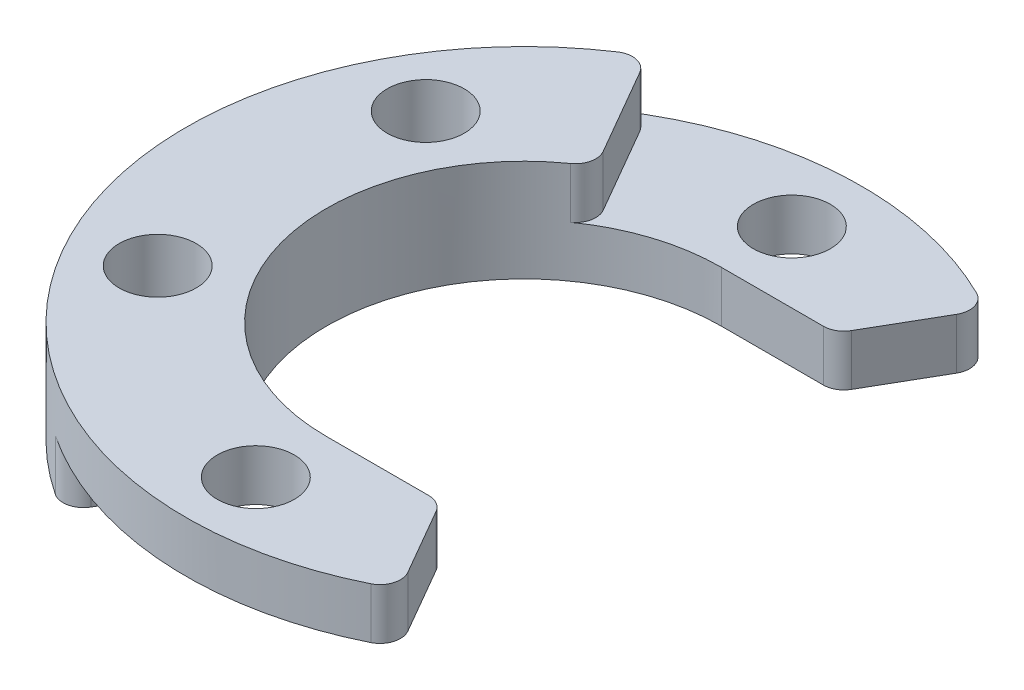
from build123d import *

# Parameters (mm, degrees)
SKETCH1_R      = 42.09650726
SKETCH1_R_2    = 24.599219473
SKETCH1_R_3    = 4.801304322
EXTRUDE1_DEPTH = 12.7
EXTRUDE2_DEPTH = 61.872997683
EXTRUDE3_DEPTH = 6.35
EXTRUDE4_DEPTH = 6.35
SKETCH6_W      = 38.310280967
SKETCH6_H      = 49.198438946
EXTRUDE5_DEPTH = 61.872997683
FILLET1_R      = 2.54
FILLET2_R      = 2.54


with BuildPart() as part:
    # Sketch1 → Extrude1 (new body)
    with BuildSketch(Plane(origin=(0, 0, 0), x_dir=(1, 0, 0), z_dir=(0, 1, 0))):
        with Locations(Location((0, 0, 0), (0, 0, 270))):
            Circle(SKETCH1_R)
        with Locations(Location((0, 0, 0), (0, 0, 270))):
            Circle(SKETCH1_R_2, mode=Mode.SUBTRACT)
        with Locations(Location((0, 33.393093385, 0), (0, 0, 270))):
            Circle(SKETCH1_R_3, mode=Mode.SUBTRACT)
        with Locations(Location((28.919267183, 16.696546693, 0), (0, 0, 270))):
            Circle(SKETCH1_R_3, mode=Mode.SUBTRACT)
        with Locations(Location((28.919267183, -16.696546693, 0), (0, 0, 270))):
            Circle(SKETCH1_R_3, mode=Mode.SUBTRACT)
        with Locations(Location((0, -33.393093385, 0), (0, 0, 270))):
            Circle(SKETCH1_R_3, mode=Mode.SUBTRACT)
        with Locations(Location((-28.919267183, -16.696546693, 0), (0, 0, 270))):
            Circle(SKETCH1_R_3, mode=Mode.SUBTRACT)
        with Locations(Location((-28.919267183, 16.696546693, 0), (0, 0, 270))):
            Circle(SKETCH1_R_3, mode=Mode.SUBTRACT)
    extrude(amount=EXTRUDE1_DEPTH)

    # Sketch3 → Extrude2 (cut, through all)
    with BuildSketch(Plane(origin=(0, 12.7, 0), x_dir=(1, 0, 0), z_dir=(0, 1, 0))):
        Polygon((0, 0), (28.178976679, 48.807419314), (52.099648294, 15.101619163), (29.402207, -50.926116379), align=None)
    extrude(amount=-EXTRUDE2_DEPTH, mode=Mode.SUBTRACT)

    # Sketch4 → Extrude3 (cut)
    with BuildSketch(Plane(origin=(0, 12.7, 0), x_dir=(1, 0, 0), z_dir=(0, 1, 0))):
        Polygon((0, 0), (-31.678815479, 54.869317933), (34.182730787, 54.869317933), align=None)
    extrude(amount=-EXTRUDE3_DEPTH, mode=Mode.SUBTRACT)

    # Sketch5 → Extrude4 (cut)
    with BuildSketch(Plane.XZ):
        Polygon((0, 0), (-26.213048705, 45.402332179), (26.21514135, 52.666998523), (26.748068273, 5.163813809), align=None)
    extrude(amount=-EXTRUDE4_DEPTH, mode=Mode.SUBTRACT)

    # Sketch6 → Extrude5 (cut, through all)
    with BuildSketch(Plane.XZ):
        with Locations((19.155140484, 0)):
            Rectangle(SKETCH6_W, SKETCH6_H)
    extrude(amount=-EXTRUDE5_DEPTH, mode=Mode.SUBTRACT)

    # Fillet1
    fillet1_edges = [part.edges().sort_by_distance(p)[0] for p in [
        (14.202365985, 3.175, -24.599219473),
        (14.202365985, 9.525, 24.599219473),
        (21.04825363, 3.175, -36.456644697),
        (21.04825363, 9.525, 36.456644697),
    ]]
    fillet(fillet1_edges, radius=FILLET1_R)

    # Fillet2
    fillet2_edges = [part.edges().sort_by_distance(p)[0] for p in [
        (-12.299609737, 9.525, -21.303548977),
        (-21.04825363, 9.525, -36.456644697),
        (-12.299609737, 3.175, 21.303548977),
        (-21.04825363, 3.175, 36.456644697),
    ]]
    fillet(fillet2_edges, radius=FILLET2_R)


solid = part.part
